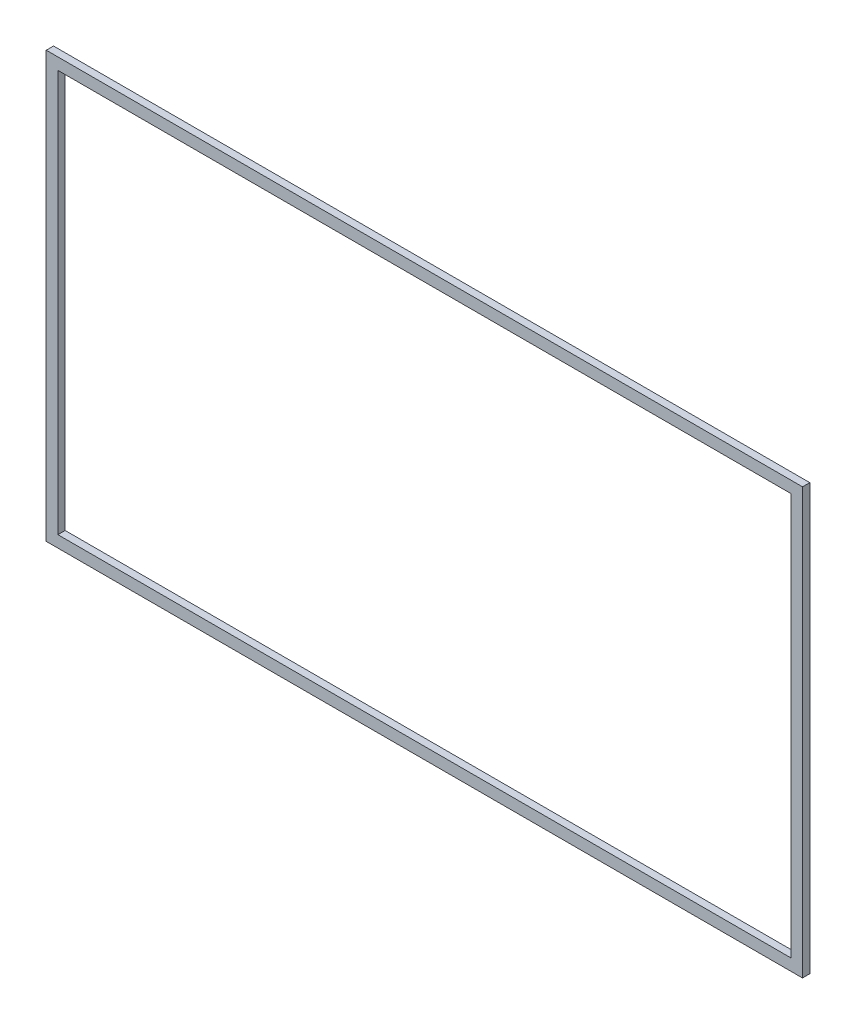
from build123d import *

# Parameters (mm, degrees)
SKETCH_1_W      = 52
SKETCH_1_H      = 29.25
SKETCH_1_W_2    = 50.4
SKETCH_1_H_2    = 27.65
EXTRUDE_1_DEPTH = 0.5


with BuildPart() as part:
    # 草图1 → 凸台-拉伸1 (new body)
    with BuildSketch(Plane.XY):
        Rectangle(SKETCH_1_W, SKETCH_1_H)
        Rectangle(SKETCH_1_W_2, SKETCH_1_H_2, mode=Mode.SUBTRACT)
    extrude(amount=EXTRUDE_1_DEPTH)


solid = part.part
